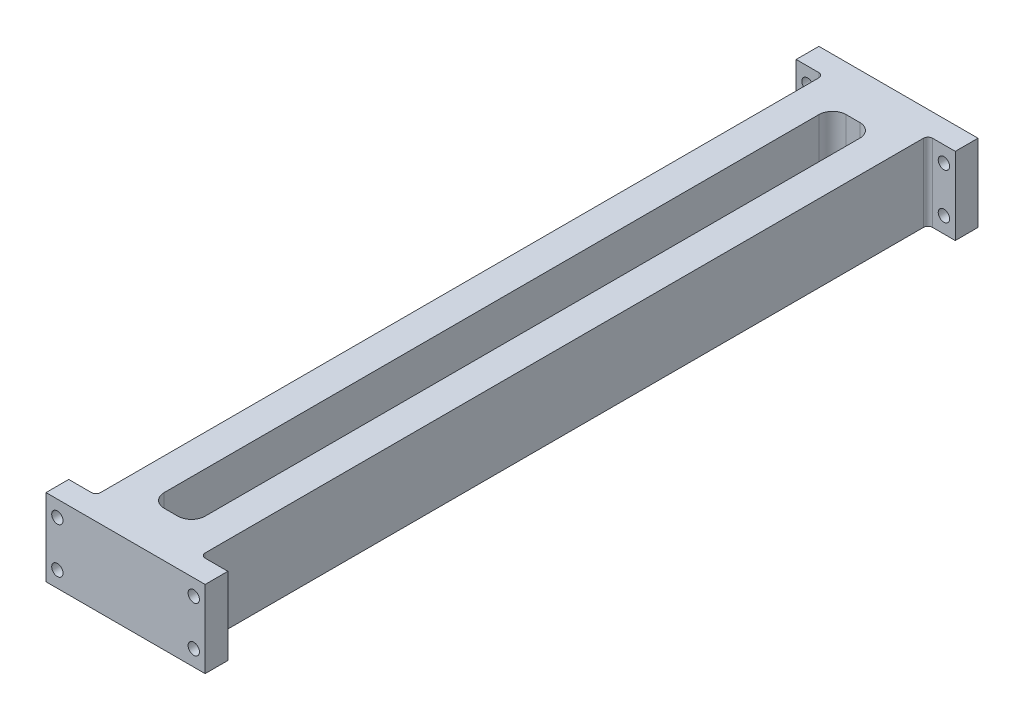
from build123d import *

# Parameters (mm, degrees)
SKETCH1_W           = 29.21
SKETCH1_H           = 21.59
BOSS_EXTRUDE1_DEPTH = 101.6
SKETCH2_W           = 44.45
SKETCH2_H           = 21.59
SKETCH2_R           = 1.5875
BOSS_EXTRUDE2_DEPTH = 6.35
FILLET1_R           = 1.27
SKETCH3_W           = 11.43
SKETCH3_H           = 190.5
CUT_EXTRUDE1_DEPTH  = 113.3088653
FILLET2_R           = 3.81


with BuildPart() as part:
    # Sketch1 → Boss-Extrude1 (new, symmetric)
    with BuildSketch(Plane.XY):
        Rectangle(SKETCH1_W, SKETCH1_H)
    extrude(amount=BOSS_EXTRUDE1_DEPTH, both=True)

    # Sketch2 → Boss-Extrude2 (add)
    with BuildSketch(Plane.XY.offset(101.6)):
        Rectangle(SKETCH2_W, SKETCH2_H)
        with Locations((-19.05, 6.35)):
            Circle(SKETCH2_R, mode=Mode.SUBTRACT)
        with Locations(Location((-19.05, -6.35, 0), (0, 0, 180))):
            Circle(SKETCH2_R, mode=Mode.SUBTRACT)
        with Locations((19.05, -6.35)):
            Circle(SKETCH2_R, mode=Mode.SUBTRACT)
        with Locations(Location((19.05, 6.35, 0), (0, 0, 180))):
            Circle(SKETCH2_R, mode=Mode.SUBTRACT)
    boss_extrude2 = extrude(amount=BOSS_EXTRUDE2_DEPTH)

    # Mirror1: Boss-Extrude2 across plane
    add(boss_extrude2.mirror(Plane.XY))

    # Fillet1
    fillet1_edges = [part.edges().sort_by_distance(p)[0] for p in [
        (14.605, 0, 101.6),
        (-14.605, 0, 101.6),
        (14.605, 0, -101.6),
        (-14.605, 0, -101.6),
    ]]
    fillet(fillet1_edges, radius=FILLET1_R)

    # Sketch3 → Cut-Extrude1 (cut, through all)
    with BuildSketch(Plane(origin=(0, 10.795, 0), x_dir=(1, 0, 0), z_dir=(0, 1, 0))):
        Rectangle(SKETCH3_W, SKETCH3_H)
    extrude(amount=-CUT_EXTRUDE1_DEPTH, mode=Mode.SUBTRACT)

    # Fillet2
    fillet2_edges = [part.edges().sort_by_distance(p)[0] for p in [
        (-5.715, 0, -95.25),
        (5.715, 0, -95.25),
        (5.715, 0, 95.25),
        (-5.715, 0, 95.25),
    ]]
    fillet(fillet2_edges, radius=FILLET2_R)


solid = part.part
